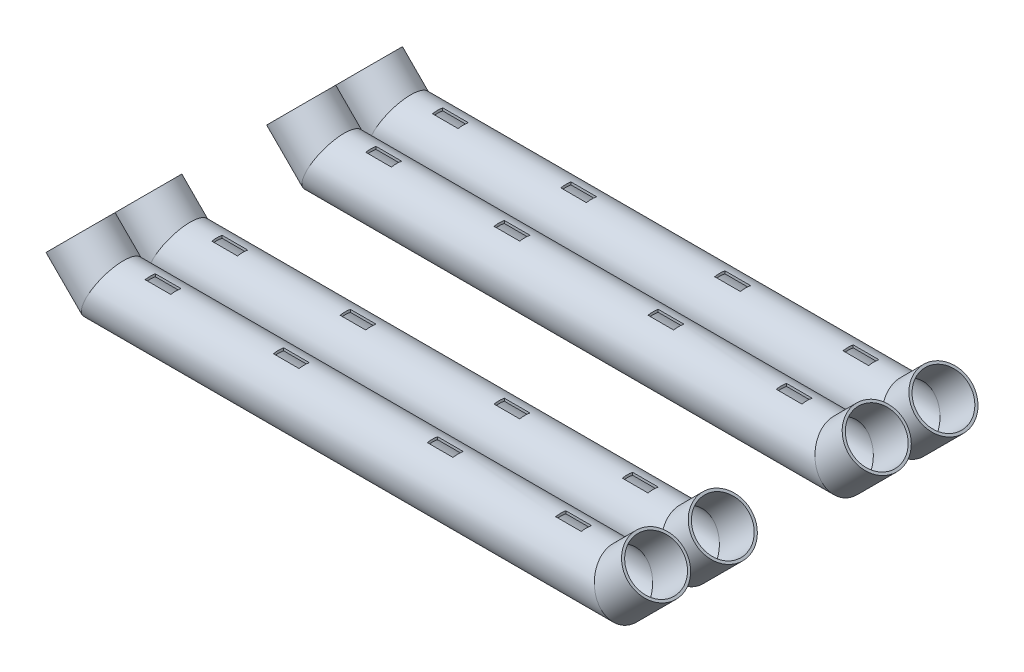
from build123d import *

# Parameters (mm, degrees)
SKETCH_8_R          = 55
SKETCH_8_R_2        = 50
SKETCH_9_R          = 55
SKETCH_9_R_2        = 50
CUT_EXTRUDE_START   = 48.989795
SKETCH_10_W         = 50
SKETCH_10_H         = 20
CUT_EXTRUDE_2_DEPTH = 6.010205
SKETCH_12_R         = 55
SKETCH_12_R_2       = 50
SKETCH_13_W         = 50
SKETCH_13_H         = 20
CUT_EXTRUDE_4_DEPTH = 60


with BuildPart() as part:
    # По траектории2: sweep along a path in Эскиз4
    with BuildLine(Plane.XY.offset(150)) as sweep_2_path:
        Line((60.811183182, 60.811183182), (0, 0))
        Line((0, 0), (-1000, 0))
        Line((-1000, 0), (-1060.811183182, 60.811183182))
    # Эскиз8 → По траектории2 (sweep)
    with BuildSketch(Plane(origin=(0, 0, 0), x_dir=(0, 0, -1), z_dir=(1, 0, 0))):
        with Locations((-150, 0)):
            Circle(SKETCH_8_R)
        with Locations((-150, 0)):
            Circle(SKETCH_8_R_2, mode=Mode.SUBTRACT)
    sweep(path=sweep_2_path.line, transition=Transition.RIGHT)


with BuildPart() as body_2:
    # По траектории3: sweep along a path in Эскиз7
    with BuildLine(Plane.XY.offset(-150)) as sweep_3_path:
        Line((-1060.811183182, 60.811183182), (-1000, 0))
        Line((-1000, 0), (0, 0))
        Line((0, 0), (60.811183182, 60.811183182))
    # Эскиз9 → По траектории3 (sweep)
    with BuildSketch(Plane(origin=(0, 0, 0), x_dir=(0, 0, -1), z_dir=(1, 0, 0))):
        with Locations((150, 0)):
            Circle(SKETCH_9_R)
        with Locations((150, 0)):
            Circle(SKETCH_9_R_2, mode=Mode.SUBTRACT)
    sweep(path=sweep_3_path.line, transition=Transition.RIGHT)


with BuildPart() as cut_extrude_2_tool:
    # Эскиз10 → Вырез-Вытянуть2 (new body)
    with BuildSketch(Plane(origin=(0, 0, 0), x_dir=(1, 0, 0), z_dir=(0, 1, 0)).offset(CUT_EXTRUDE_START)):
        with Locations((-900, 150)):
            Rectangle(SKETCH_10_W, SKETCH_10_H)
        with Locations((-100, 150)):
            Rectangle(SKETCH_10_W, SKETCH_10_H)
        with Locations((-100, -150)):
            Rectangle(SKETCH_10_W, SKETCH_10_H)
        with Locations((-900, -150)):
            Rectangle(SKETCH_10_W, SKETCH_10_H)
        with Locations((-350, 150)):
            Rectangle(SKETCH_10_W, SKETCH_10_H)
        with Locations((-650, 150)):
            Rectangle(SKETCH_10_W, SKETCH_10_H)
        with Locations((-350, -150)):
            Rectangle(SKETCH_10_W, SKETCH_10_H)
        with Locations((-650, -150)):
            Rectangle(SKETCH_10_W, SKETCH_10_H)
    extrude(amount=CUT_EXTRUDE_2_DEPTH)


with BuildPart() as part_1:
    add(part.part)

    # Вырез-Вытянуть2: cut by cut_extrude_2_tool
    add(cut_extrude_2_tool.part, mode=Mode.SUBTRACT)


with BuildPart() as body_2_1:
    add(body_2.part)

    # Вырез-Вытянуть2: cut by cut_extrude_2_tool
    add(cut_extrude_2_tool.part, mode=Mode.SUBTRACT)


with BuildPart() as body_3:
    # По траектории4: sweep along a path in Эскиз11
    with BuildLine(Plane.XY.offset(-280)) as sweep_4_path:
        Line((-1060.811183182, 60.811183182), (-1000, 0))
        Line((-1000, 0), (0, 0))
        Line((0, 0), (60.811183182, 60.811183182))
    # Эскиз12 → По траектории4 (sweep)
    # profile 1 of 2: a face of its own
    with BuildSketch(Plane(origin=(0, 0, 0), x_dir=(0, 0, -1), z_dir=(1, 0, 0))):
        with Locations((280, 0)):
            Circle(SKETCH_12_R)
        with Locations((280, 0)):
            Circle(SKETCH_12_R_2, mode=Mode.SUBTRACT)
    # profile 2 of 2: a face of its own
    with BuildSketch(Plane(origin=(0, 0, 0), x_dir=(0, 0, -1), z_dir=(1, 0, 0))):
        with Locations((-280, 0)):
            Circle(SKETCH_12_R)
        with Locations((-280, 0)):
            Circle(SKETCH_12_R_2, mode=Mode.SUBTRACT)
    sweep(path=sweep_4_path.line, transition=Transition.RIGHT)

    # Эскиз13 → Вырез-Вытянуть4 (cut)
    with BuildSketch(Plane(origin=(0, 0, 0), x_dir=(1, 0, 0), z_dir=(0, 1, 0))):
        with Locations((-900, 280)):
            Rectangle(SKETCH_13_W, SKETCH_13_H)
        with Locations((-650, 280)):
            Rectangle(SKETCH_13_W, SKETCH_13_H)
        with Locations((-350, 280)):
            Rectangle(SKETCH_13_W, SKETCH_13_H)
        with Locations((-100, 280)):
            Rectangle(SKETCH_13_W, SKETCH_13_H)
        with Locations((-100, -280)):
            Rectangle(SKETCH_13_W, SKETCH_13_H)
        with Locations((-350, -280)):
            Rectangle(SKETCH_13_W, SKETCH_13_H)
        with Locations((-650, -280)):
            Rectangle(SKETCH_13_W, SKETCH_13_H)
        with Locations((-900, -280)):
            Rectangle(SKETCH_13_W, SKETCH_13_H)
    extrude(amount=CUT_EXTRUDE_4_DEPTH, mode=Mode.SUBTRACT)


solid = Compound([part_1.part, body_2_1.part, body_3.part])
